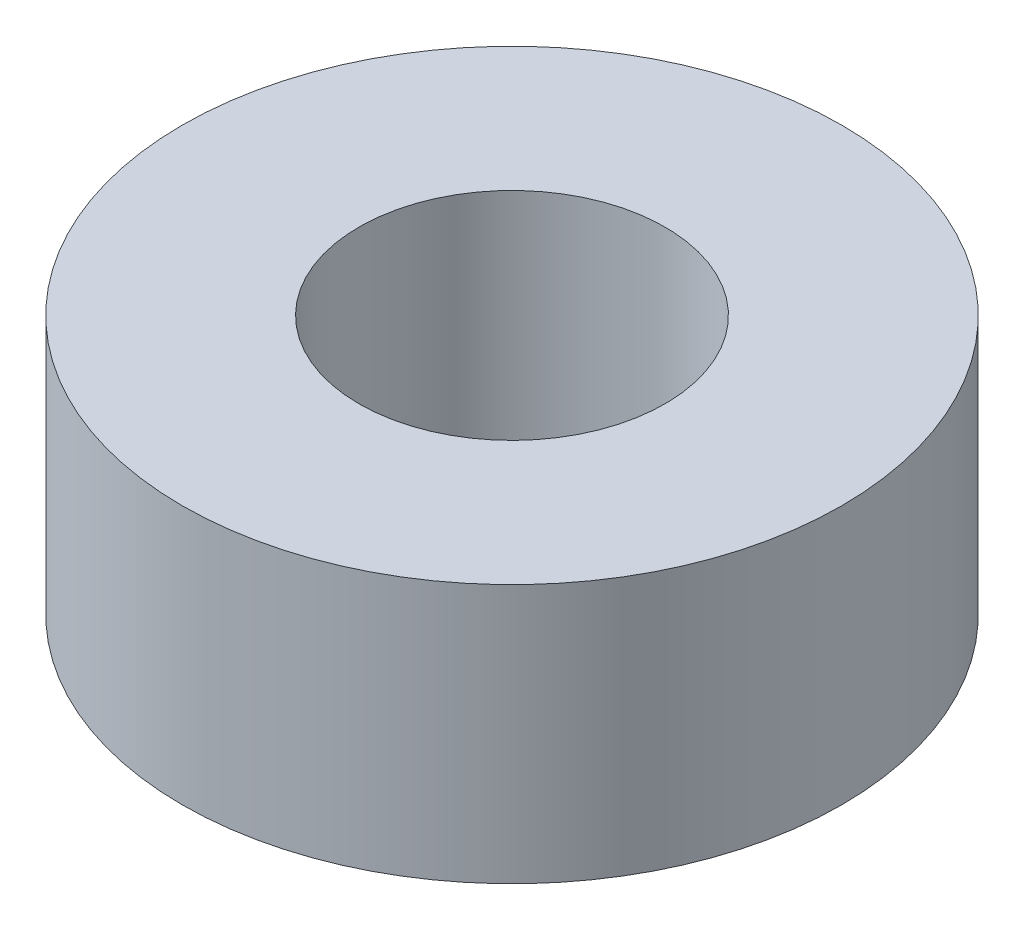
from build123d import *

# Parameters (mm, degrees)
SKETCH1_R           = 3.5
SKETCH1_R_2         = 1.625
BOSS_EXTRUDE1_DEPTH = 2.75


with BuildPart() as part:
    # Sketch1 → Boss-Extrude1 (new body)
    with BuildSketch(Plane(origin=(0, 0, 0), x_dir=(1, 0, 0), z_dir=(0, 1, 0))):
        with Locations(Location((0, 0, 0), (0, 0, 270))):
            Circle(SKETCH1_R)
        with Locations(Location((0, 0, 0), (0, 0, 270))):
            Circle(SKETCH1_R_2, mode=Mode.SUBTRACT)
    extrude(amount=BOSS_EXTRUDE1_DEPTH)


solid = part.part
